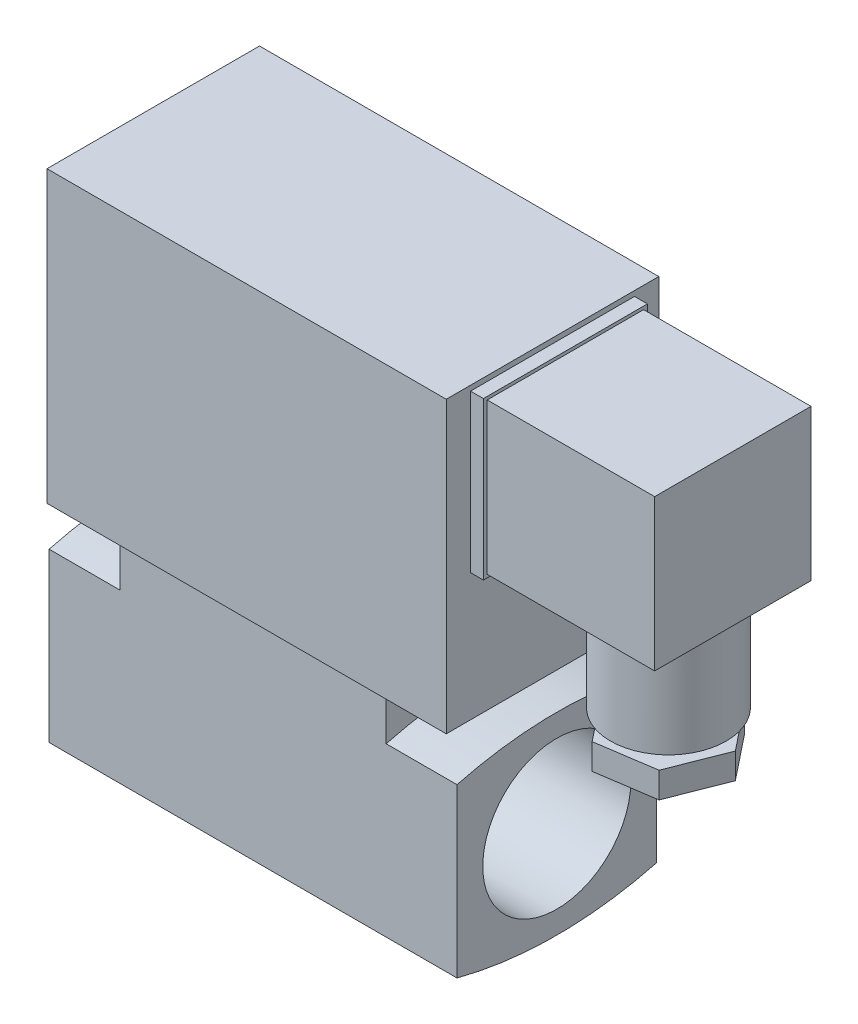
from build123d import *

# Parameters (mm, degrees)
CROQUIS1_W               = 62
CROQUIS1_H               = 45
SALIENTE_EXTRUIR1_DEPTH  = 33
CROQUIS2_W               = 25.463929144
CROQUIS2_H               = 24.410779192
SALIENTE_EXTRUIR2_DEPTH  = 2
CROQUIS3_W               = 24.282059014
CROQUIS3_H               = 23.443794542
SALIENTE_EXTRUIR3_DEPTH  = 26
CROQUIS5_W               = 41.33364391
CROQUIS5_H               = 31
SALIENTE_EXTRUIR5_DEPTH  = 35
CROQUIS6_W               = 31
CROQUIS6_H               = 30
SALIENTE_EXTRUIR6_DEPTH  = 11
CROQUIS7_W               = 31
CROQUIS7_H               = 30
SALIENTE_EXTRUIR7_DEPTH  = 11
CORTAR_EXTRUIR1_DEPTH    = 11
CORTAR_EXTRUIR2_DEPTH    = 52.33364391
CORTAR_EXTRUIR3_START    = -11
CORTAR_EXTRUIR3_DEPTH    = 11
CROQUIS17_R              = 9
SALIENTE_EXTRUIR8_DEPTH  = 16
CROQUIS18_R              = 5.625205596
SALIENTE_EXTRUIR9_DEPTH  = 2
SALIENTE_EXTRUIR10_DEPTH = 4
CROQUIS20_R              = 11.5
CORTAR_EXTRUIR6_DEPTH    = 63.33364391


with BuildPart() as part:
    # Croquis1 → Saliente-Extruir1 (new body)
    with BuildSketch(Plane.XY):
        with Locations((31, -22.5)):
            Rectangle(CROQUIS1_W, CROQUIS1_H)
    extrude(amount=SALIENTE_EXTRUIR1_DEPTH)

    # Croquis2 → Saliente-Extruir2 (add)
    with BuildSketch(Plane(origin=(62, 0, 0), x_dir=(0, 0, -1), z_dir=(1, 0, 0))):
        with Locations((-16.5, -13)):
            Rectangle(CROQUIS2_W, CROQUIS2_H)
    extrude(amount=SALIENTE_EXTRUIR2_DEPTH)

    # Croquis3 → Saliente-Extruir3 (add)
    with BuildSketch(Plane(origin=(64, 0, 0), x_dir=(0, 0, -1), z_dir=(1, 0, 0))):
        with Locations((-16.5, -13)):
            Rectangle(CROQUIS3_W, CROQUIS3_H)
    extrude(amount=SALIENTE_EXTRUIR3_DEPTH)

    # Croquis5 → Saliente-Extruir5 (add)
    with BuildSketch(Plane.XZ.offset(45)):
        with Locations((31, 16.5)):
            Rectangle(CROQUIS5_W, CROQUIS5_H)
    extrude(amount=SALIENTE_EXTRUIR5_DEPTH)

    # Croquis6 → Saliente-Extruir6 (add)
    with BuildSketch(Plane(origin=(51.666821955, 0, 0), x_dir=(0, 0, -1), z_dir=(1, 0, 0))):
        with Locations((-16.5, -65)):
            Rectangle(CROQUIS6_W, CROQUIS6_H)
    extrude(amount=SALIENTE_EXTRUIR6_DEPTH)

    # Croquis7 → Saliente-Extruir7 (add)
    with BuildSketch(Plane.ZY.offset(-10.333178045)):
        with Locations((16.5, -65)):
            Rectangle(CROQUIS7_W, CROQUIS7_H)
    extrude(amount=SALIENTE_EXTRUIR7_DEPTH)

    # Croquis8 → Cortar-Extruir1 (cut)
    with BuildSketch(Plane(origin=(62.666821955, 0, 0), x_dir=(0, 0, -1), z_dir=(1, 0, 0))):
        with BuildLine():
            Line((-32, -80), (-32, -78))
            ThreePointArc((-32, -78), (-16.5, -80), (-1, -78))
            Line((-1, -78), (0.928970142, -80.475031326))
            Line((0.928970142, -80.475031326), (-0.274135128, -81.99339903))
            Line((-0.274135128, -81.99339903), (-8.695872018, -84.279445288))
            Line((-8.695872018, -84.279445288), (-24.986567701, -83.98679806))
            Line((-24.986567701, -83.98679806), (-32, -80))
        make_face()
        with BuildLine():
            Line((-32, -52), (-33.723093641, -49.93126323))
            Line((-33.723093641, -49.93126323), (-34.225322301, -47.788491738))
            Line((-34.225322301, -47.788491738), (-30.90530883, -47.311645213))
            Line((-30.90530883, -47.311645213), (-17.951536569, -46.72536261))
            Line((-17.951536569, -46.72536261), (-10.133210988, -47.311645213))
            Line((-10.133210988, -47.311645213), (0, -48.071517035))
            Line((0, -48.071517035), (0, -49))
            Line((0, -49), (-1, -52))
            ThreePointArc((-1, -52), (-16.5, -50), (-32, -52))
        make_face()
    extrude(amount=-CORTAR_EXTRUIR1_DEPTH, mode=Mode.SUBTRACT)

    # Croquis9 → Cortar-Extruir2 (cut)
    with BuildSketch(Plane(origin=(51.666821955, 0, 0), x_dir=(0, 0, -1), z_dir=(1, 0, 0))):
        with BuildLine():
            Line((-32, -78), (-33.497607454, -80))
            Line((-33.497607454, -80), (-33.497607454, -82.886987671))
            Line((-33.497607454, -82.886987671), (-32, -84.384595125))
            Line((-32, -84.384595125), (-22.575228316, -85.712467989))
            Line((-22.575228316, -85.712467989), (-14.351815451, -85.712467989))
            Line((-14.351815451, -85.712467989), (-8.532169423, -85.048531557))
            Line((-8.532169423, -85.048531557), (-1, -84.384595125))
            Line((-1, -84.384595125), (0.769167017, -82.615428108))
            Line((0.769167017, -82.615428108), (1.462440059, -80.483220833))
            Line((1.462440059, -80.483220833), (1.462440059, -79))
            Line((1.462440059, -79), (-1, -78))
            ThreePointArc((-1, -78), (-16.5, -80), (-32, -78))
        make_face()
    extrude(amount=-CORTAR_EXTRUIR2_DEPTH, mode=Mode.SUBTRACT)

    # Croquis10 → Cortar-Extruir3 (cut)
    with BuildSketch(Plane.ZY.offset(0.666821955).offset(CORTAR_EXTRUIR3_START)):
        with BuildLine():
            Line((32, -52), (34.151499122, -49.263012271))
            Line((34.151499122, -49.263012271), (33.075749561, -47.196000203))
            Line((33.075749561, -47.196000203), (22.583484216, -46.688313029))
            Line((22.583484216, -46.688313029), (7.099025391, -47.631160639))
            Line((7.099025391, -47.631160639), (-1.096496141, -48.229506237))
            Line((-1.096496141, -48.229506237), (1, -52))
            ThreePointArc((1, -52), (16.5, -50), (32, -52))
        make_face()
    extrude(amount=CORTAR_EXTRUIR3_DEPTH, mode=Mode.SUBTRACT)

    # Croquis17 → Saliente-Extruir8 (add)
    with BuildSketch(Plane.XZ.offset(24.721897271)):
        with Locations(Location((80, 16.5, 0), (0, 0, 90))):
            Circle(CROQUIS17_R)
    extrude(amount=SALIENTE_EXTRUIR8_DEPTH)

    # Croquis18 → Saliente-Extruir9 (add)
    with BuildSketch(Plane.XZ.offset(40.721897271)):
        with Locations((80, 16.5)):
            Circle(CROQUIS18_R)
    extrude(amount=SALIENTE_EXTRUIR9_DEPTH)

    # Croquis19 → Saliente-Extruir10 (add)
    with BuildSketch(Plane.XZ.offset(42.721897271)):
        Polygon((89.032919524, 15.145062071), (85.689870429, 23.645268814), (76.656950905, 25.000206743), (70.967080476, 17.854937929), (74.310129571, 9.354731186), (83.343049095, 7.999793257), align=None)
    extrude(amount=SALIENTE_EXTRUIR10_DEPTH)

    # Croquis20 → Cortar-Extruir6 (cut)
    with BuildSketch(Plane(origin=(62.666821955, 0, 0), x_dir=(0, 0, -1), z_dir=(1, 0, 0))):
        with Locations((-16.5, -65)):
            Circle(CROQUIS20_R)
    extrude(amount=-CORTAR_EXTRUIR6_DEPTH, mode=Mode.SUBTRACT)


solid = part.part
